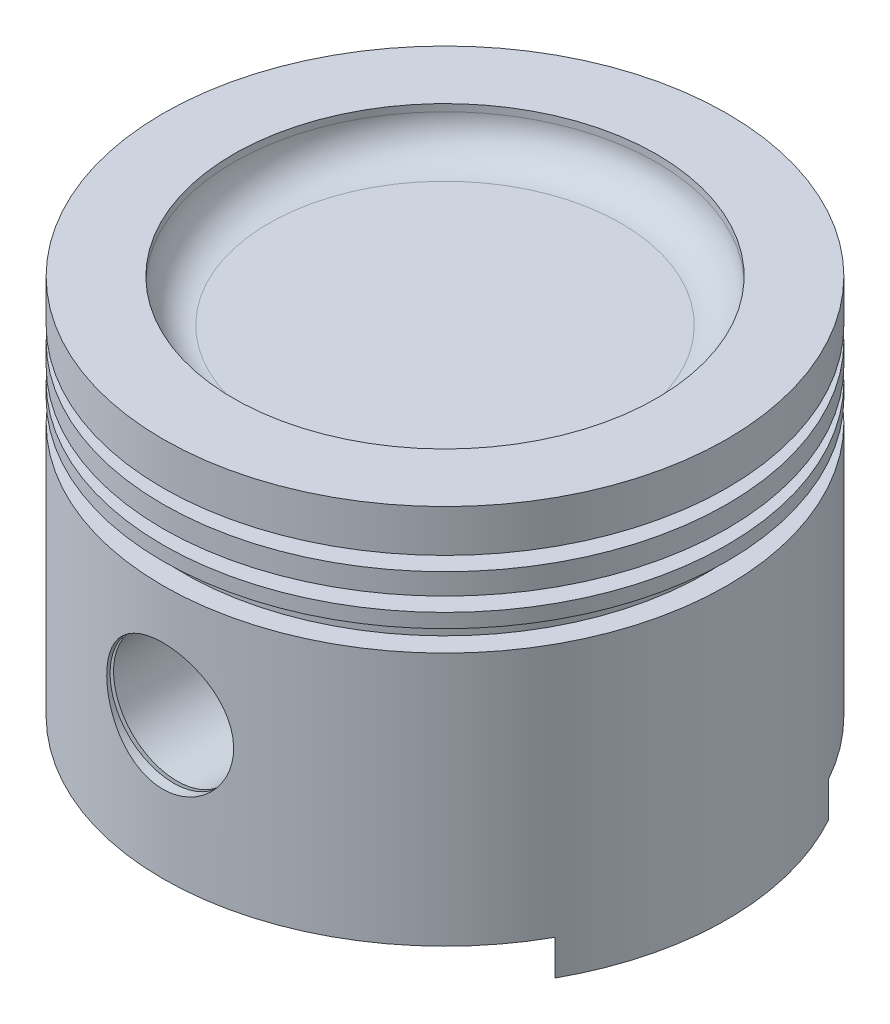
from build123d import *

# Parameters (mm, degrees)
EXTRUDE_1_REACH          = 90.826
EXTRUDE_1_END_RADIUS     = 27
SKETCH_2_R               = 13
SKETCH_4_R               = 9
CUT_EXTRUDE_2_DEPTH      = 89.825671965
SKETCH_5_R               = 10
CUT_EXTRUDE_3_DEPTH      = 0.5
EXTRUDE_1_2_REACH        = 90.826
CUT_EXTRUDE_4_DEPTH      = 82.737384446
CUT_EXTRUDE_4_DEPTH_BACK = 82.737384446
SKETCH_6_W               = 70
SKETCH_6_H               = 5


with BuildPart() as part:
    # 草图1 → 旋转1 (revolve)
    with BuildSketch(Plane.XY, mode=Mode.PRIVATE) as revolve_1_sk:
        with BuildLine():
            Line((0, 53), (25, 53))
            ThreePointArc((25, 53), (28.535533906, 54.464466094), (30, 58))
            Line((30, 58), (30, 59))
            Line((30, 59), (40, 59))
            Line((40, 59), (40, 53))
            Line((40, 53), (37, 53))
            Line((37, 53), (37, 51))
            Line((37, 51), (40, 51))
            Line((40, 51), (40, 48))
            Line((40, 48), (37, 48))
            Line((37, 48), (37, 46))
            Line((37, 46), (40, 46))
            Line((40, 46), (40, 44))
            Line((40, 44), (37, 44))
            Line((37, 44), (37, 41))
            Line((37, 41), (40, 41))
            Line((40, 41), (40, 0))
            Line((40, 0), (27, 0))
            Line((27, 0), (27, 41.5))
            ThreePointArc((27, 41.5), (25.535533906, 45.035533906), (22, 46.5))
            Line((22, 46.5), (0, 46.5))
            Line((0, 46.5), (0, 53))
        make_face()
    revolve(revolve_1_sk.sketch.rotate(Axis((0, -5, 0), (0, 1, 0)), 90), axis=Axis((0, -5, 0), (0, 1, 0)))

    # Extrude 1: up to this cylinder (the profile starts inside it)
    extrude_1_end = Plane(origin=(0, 25, 0), z_dir=(0, -1, 0)) * Cylinder(EXTRUDE_1_END_RADIUS, 236.652, mode=Mode.PRIVATE)
    # 草图2 → Extrude 1 (add, up to the surface)
    with BuildSketch(Plane.XY.offset(13), mode=Mode.PRIVATE) as extrude_1_sk1:
        with Locations(Location((0, 25, 0), (0, 0, 180))):
            Circle(SKETCH_2_R)
    extrude_1_tool1 = extrude(extrude_1_sk1.sketch, amount=EXTRUDE_1_REACH, mode=Mode.PRIVATE) & extrude_1_end
    extrude_1 = extrude_1_tool1.solids().sort_by_distance((0, 25, 13))[0]
    add(extrude_1)

    # 草图4 → 切除-拉伸2 (cut, through all)
    with BuildSketch(Plane.XY.offset(13)):
        with Locations(Location((0, 25, 0), (0, 0, 270))):
            Circle(SKETCH_4_R)
    cut_extrude_2 = extrude(amount=CUT_EXTRUDE_2_DEPTH, mode=Mode.SUBTRACT)

    # 草图5 → 切除-拉伸3 (cut)
    with BuildSketch(Plane.XY.offset(38)):
        with Locations((0, 25)):
            Circle(SKETCH_5_R)
    cut_extrude_3 = extrude(amount=CUT_EXTRUDE_3_DEPTH, mode=Mode.SUBTRACT)

    # 草图7 → Extrude 1 2 (add, up to next)
    with BuildSketch(Plane(origin=(0, 0, 13), x_dir=(-1, 0, 0), z_dir=(0, 0, -1)), mode=Mode.PRIVATE) as extrude_1_2_sk1:
        with BuildLine():
            Line((-13, 25), (-13, 46.5))
            Line((-13, 46.5), (13, 46.5))
            Line((13, 46.5), (13, 25))
            ThreePointArc((13, 25), (0, 38), (-13, 25))
        make_face()
    extrude_1_2_tool1 = extrude(extrude_1_2_sk1.sketch, amount=-EXTRUDE_1_2_REACH, mode=Mode.PRIVATE) - part.part
    extrude_1_2 = extrude_1_2_tool1.solids().sort_by_distance((0, 40.482231, 13))[0]
    add(extrude_1_2)

    # 镜向1: Extrude 1, 切除-拉伸2, 切除-拉伸3, Extrude 1 2 across plane
    add(extrude_1.mirror(Plane.XY))
    add(cut_extrude_2.mirror(Plane.XY), mode=Mode.SUBTRACT)
    add(cut_extrude_3.mirror(Plane.XY), mode=Mode.SUBTRACT)
    add(extrude_1_2.mirror(Plane.XY))

    # 草图6 → 切除-拉伸4 (cut, two sides: drawn at the far end of the back side and taken through both)
    with BuildSketch(Plane.XY.offset(-CUT_EXTRUDE_4_DEPTH_BACK)):
        with Locations((0, 2.5)):
            Rectangle(SKETCH_6_W, SKETCH_6_H)
    extrude(amount=CUT_EXTRUDE_4_DEPTH + CUT_EXTRUDE_4_DEPTH_BACK, mode=Mode.SUBTRACT)


solid = part.part
